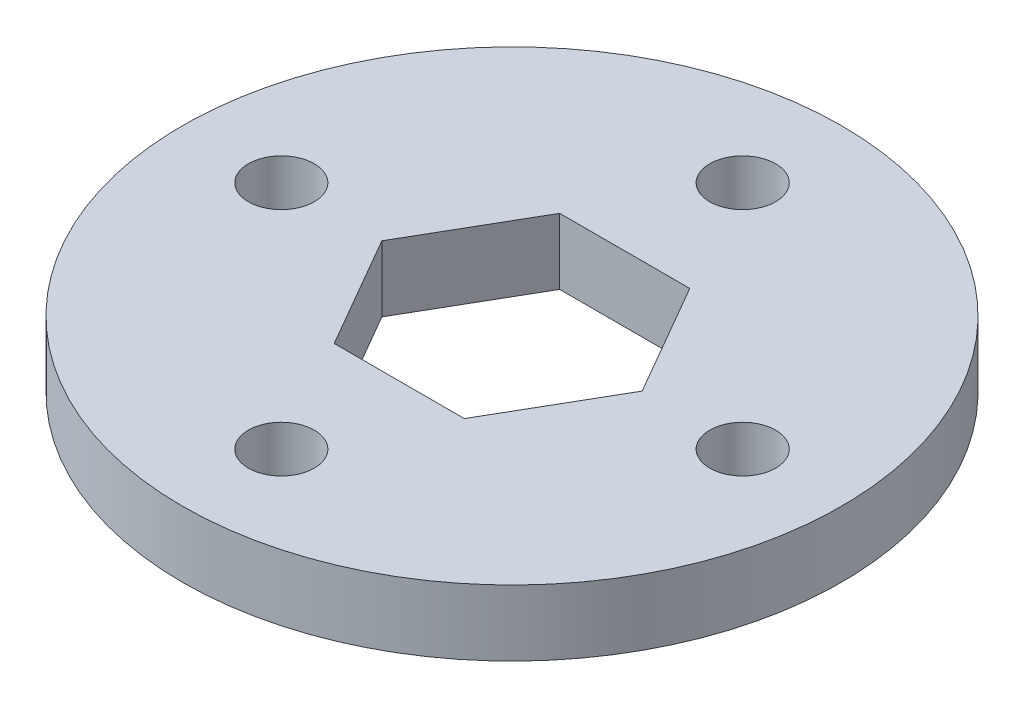
from build123d import *

# Parameters (mm, degrees)
SKETCH1_R           = 25
BOSS_EXTRUDE1_DEPTH = 5
SKETCH3_R           = 2.5
CUT_EXTRUDE1_DEPTH  = 18


with BuildPart() as part:
    # Sketch1 → Boss-Extrude1 (new body)
    with BuildSketch(Plane(origin=(0, 0, 0), x_dir=(1, 0, 0), z_dir=(0, 1, 0))):
        with Locations(Location((0, 0, 0), (0, 0, 270))):
            Circle(SKETCH1_R)
        Polygon((-9.872689603, 0), (-4.936344802, -8.55), (4.936344802, -8.55), (9.872689603, 0), (4.936344802, 8.55), (-4.936344802, 8.55), align=None, mode=Mode.SUBTRACT)
    extrude(amount=BOSS_EXTRUDE1_DEPTH)

    # Sketch3 → Cut-Extrude1 (cut)
    with BuildSketch(Plane(origin=(0, 5, 0), x_dir=(1, 0, 0), z_dir=(0, 1, 0))):
        with Locations(Location((0, 17.5, 0), (0, 0, 270))):
            Circle(SKETCH3_R)
        with Locations(Location((17.5, 0, 0), (0, 0, 270))):
            Circle(SKETCH3_R)
        with Locations(Location((0, -17.5, 0), (0, 0, 270))):
            Circle(SKETCH3_R)
        with Locations(Location((-17.5, 0, 0), (0, 0, 270))):
            Circle(SKETCH3_R)
    extrude(amount=-CUT_EXTRUDE1_DEPTH, mode=Mode.SUBTRACT)


solid = part.part
